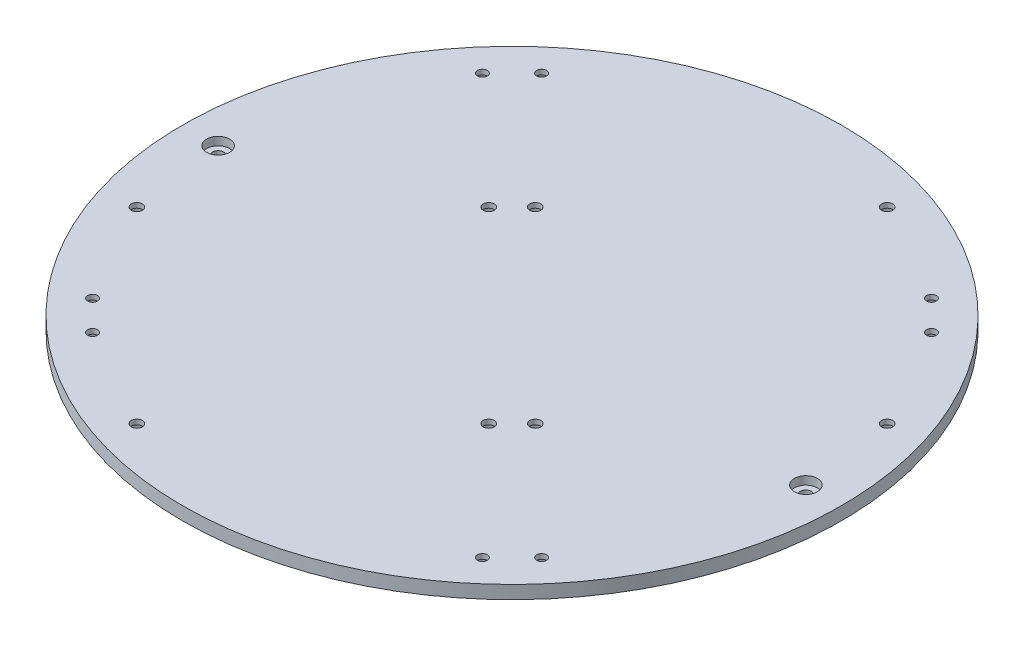
from build123d import *

# Parameters (mm, degrees)
SKETCH2_R           = 100
SKETCH2_R_2         = 1.49
SKETCH2_R_3         = 1.7
BOSS_EXTRUDE1_DEPTH = 4
SKETCH3_R           = 1.7
CUT_EXTRUDE1_DEPTH  = 10
CUT_EXTRUDE2_START  = -4
SKETCH4_R           = 3.5
CUT_EXTRUDE2_DEPTH  = 2.5
SKETCH5_R           = 3.5
CUT_EXTRUDE3_DEPTH  = 2.5


with BuildPart() as part:
    # Sketch2 → Boss-Extrude1 (new body)
    with BuildSketch(Plane(origin=(0, 0, 0), x_dir=(1, 0, 0), z_dir=(0, 1, 0))):
        with Locations(Location((0, 0, 0), (0, 0, 270))):
            Circle(SKETCH2_R)
        with Locations(Location((59.149482246, -68.129738367, 0), (0, 0, 270))):
            Circle(SKETCH2_R_2, mode=Mode.SUBTRACT)
        with Locations(Location((68.129738367, -59.149482246, 0), (0, 0, 270))):
            Circle(SKETCH2_R_2, mode=Mode.SUBTRACT)
        with Locations(Location((-59.149482246, 68.129738367, 0), (0, 0, 270))):
            Circle(SKETCH2_R_2, mode=Mode.SUBTRACT)
        with Locations(Location((-68.129738367, 59.149482246, 0), (0, 0, 270))):
            Circle(SKETCH2_R_2, mode=Mode.SUBTRACT)
        with Locations(Location((-59.149482246, -68.129738367, 0), (0, 0, 270))):
            Circle(SKETCH2_R_2, mode=Mode.SUBTRACT)
        with Locations(Location((-68.129738367, -59.149482246, 0), (0, 0, 270))):
            Circle(SKETCH2_R_2, mode=Mode.SUBTRACT)
        with Locations(Location((68.129738367, 59.149482246, 0), (0, 0, 270))):
            Circle(SKETCH2_R_2, mode=Mode.SUBTRACT)
        with Locations(Location((59.149482246, 68.129738367, 0), (0, 0, 270))):
            Circle(SKETCH2_R_2, mode=Mode.SUBTRACT)
        with Locations(Location((-89.175, 0, 0), (0, 0, 270))):
            Circle(SKETCH2_R_3, mode=Mode.SUBTRACT)
        with Locations(Location((89.175, 0, 0), (0, 0, 270))):
            Circle(SKETCH2_R_3, mode=Mode.SUBTRACT)
    extrude(amount=BOSS_EXTRUDE1_DEPTH)

    # Sketch3 → Cut-Extrude1 (cut)
    with BuildSketch(Plane(origin=(0, 4, 0), x_dir=(1, 0, 0), z_dir=(0, 1, 0))):
        with Locations(Location((-31.993836737, 24.922768925, 0), (0, 0, 270))):
            Circle(SKETCH3_R)
        with Locations(Location((-85.380398716, -28.463793055, 0), (0, 0, 270))):
            Circle(SKETCH3_R)
        with Locations(Location((28.463793055, 85.380398716, 0), (0, 0, 270))):
            Circle(SKETCH3_R)
        with Locations(Location((-24.922768925, 31.993836737, 0), (0, 0, 270))):
            Circle(SKETCH3_R)
        with Locations(Location((31.993836737, -24.922768925, 0), (0, 0, 270))):
            Circle(SKETCH3_R)
        with Locations(Location((85.380398716, 28.463793055, 0), (0, 0, 270))):
            Circle(SKETCH3_R)
        with Locations(Location((24.922768925, -31.993836737, 0), (0, 0, 270))):
            Circle(SKETCH3_R)
        with Locations(Location((-28.463793055, -85.380398716, 0), (0, 0, 270))):
            Circle(SKETCH3_R)
    extrude(amount=-CUT_EXTRUDE1_DEPTH, mode=Mode.SUBTRACT)

    # Sketch4 → Cut-Extrude2 (cut)
    with BuildSketch(Plane(origin=(0, 4, 0), x_dir=(1, 0, 0), z_dir=(0, 1, 0)).offset(CUT_EXTRUDE2_START)):
        with Locations(Location((-85.380398716, -28.463793055, 0), (0, 0, 270))):
            Circle(SKETCH4_R)
        with Locations(Location((-68.129738367, -59.149482246, 0), (0, 0, 270))):
            Circle(SKETCH4_R)
        with Locations(Location((-59.149482246, -68.129738367, 0), (0, 0, 270))):
            Circle(SKETCH4_R)
        with Locations(Location((-28.463793055, -85.380398716, 0), (0, 0, 270))):
            Circle(SKETCH4_R)
        with Locations(Location((59.149482246, -68.129738367, 0), (0, 0, 270))):
            Circle(SKETCH4_R)
        with Locations(Location((68.129738367, -59.149482246, 0), (0, 0, 270))):
            Circle(SKETCH4_R)
        with Locations(Location((85.380398716, 28.463793055, 0), (0, 0, 270))):
            Circle(SKETCH4_R)
        with Locations(Location((68.129738367, 59.149482246, 0), (0, 0, 270))):
            Circle(SKETCH4_R)
        with Locations(Location((59.149482246, 68.129738367, 0), (0, 0, 270))):
            Circle(SKETCH4_R)
        with Locations(Location((28.463793055, 85.380398716, 0), (0, 0, 270))):
            Circle(SKETCH4_R)
        with Locations(Location((-59.149482246, 68.129738367, 0), (0, 0, 270))):
            Circle(SKETCH4_R)
        with Locations(Location((-68.129738367, 59.149482246, 0), (0, 0, 270))):
            Circle(SKETCH4_R)
        with Locations(Location((-24.922768925, 31.993836737, 0), (0, 0, 270))):
            Circle(SKETCH4_R)
        with Locations(Location((-31.993836737, 24.922768925, 0), (0, 0, 270))):
            Circle(SKETCH4_R)
        with Locations(Location((31.993836737, -24.922768925, 0), (0, 0, 270))):
            Circle(SKETCH4_R)
        with Locations(Location((24.922768925, -31.993836737, 0), (0, 0, 270))):
            Circle(SKETCH4_R)
    extrude(amount=CUT_EXTRUDE2_DEPTH, mode=Mode.SUBTRACT)

    # Sketch5 → Cut-Extrude3 (cut)
    with BuildSketch(Plane(origin=(0, 4, 0), x_dir=(1, 0, 0), z_dir=(0, 1, 0))):
        with Locations(Location((-89.175, 0, 0), (0, 0, 270))):
            Circle(SKETCH5_R)
        with Locations(Location((89.175, 0, 0), (0, 0, 270))):
            Circle(SKETCH5_R)
    extrude(amount=-CUT_EXTRUDE3_DEPTH, mode=Mode.SUBTRACT)


solid = part.part
